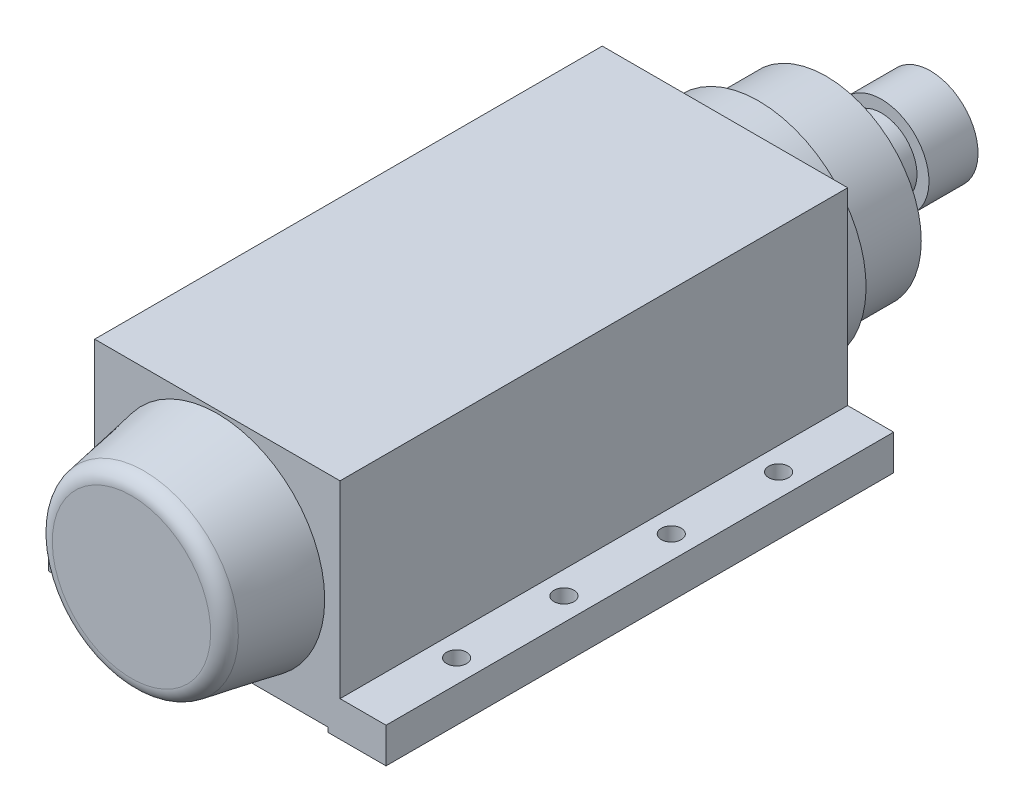
from build123d import *

# Parameters (mm, degrees)
AUFSATZ_LINEAR_AUSTRAGEN1_DEPTH = 165.5
SKIZZE3_R                       = 3.25
SCHNITT_LINEAR_AUSTRAGEN1_DEPTH = 20


with BuildPart() as part:
    # Skizze1 → Aufsatz-Linear austragen1 (new body)
    with BuildSketch(Plane.XY):
        Polygon((-36, 1.5), (36, 1.5), (36, 0), (55, 0), (55, 11.5), (40, 11.5), (40, 73), (-40, 73), (-40, 11.5), (-55, 11.5), (-55, 0), (-36, 0), align=None)
    extrude(amount=AUFSATZ_LINEAR_AUSTRAGEN1_DEPTH)

    # Skizze2 → Rotation1 (revolve)
    with BuildSketch(Plane(origin=(0, 0, 0), x_dir=(0, 0, -1), z_dir=(1, 0, 0))):
        with BuildLine():
            Line((-165.5, 72), (-189.378953192, 67.735901216))
            ThreePointArc((-189.378953192, 67.735901216), (-192.333716602, 66.023532336), (-193.5, 62.813763338))
            Line((-193.5, 62.813763338), (-193.5, 37))
            Line((-193.5, 37), (-165.5, 37))
            Line((-165.5, 37), (-165.5, 72))
        make_face()
        Polygon((0, 72), (11, 72), (11, 68), (33, 68), (33, 62), (35, 62), (36, 61.422649731), (36, 48.6), (51, 48.6), (51, 52.5), (67, 52.5), (67, 37), (0, 37), align=None)
    revolve(axis=Axis((0, 37, -51.73091969), (0, 0, 1)))

    # Skizze3 → Schnitt-Linear austragen1 (cut)
    with BuildSketch(Plane.XZ):
        with Locations((47.5, 30)):
            Circle(SKIZZE3_R)
        with Locations((47.5, 65)):
            Circle(SKIZZE3_R)
        with Locations((47.5, 100)):
            Circle(SKIZZE3_R)
        with Locations((47.5, 135)):
            Circle(SKIZZE3_R)
        with Locations((-47.5, 30)):
            Circle(SKIZZE3_R)
        with Locations((-47.5, 65)):
            Circle(SKIZZE3_R)
        with Locations((-47.5, 100)):
            Circle(SKIZZE3_R)
        with Locations((-47.5, 135)):
            Circle(SKIZZE3_R)
    extrude(amount=-SCHNITT_LINEAR_AUSTRAGEN1_DEPTH, mode=Mode.SUBTRACT)


solid = part.part
